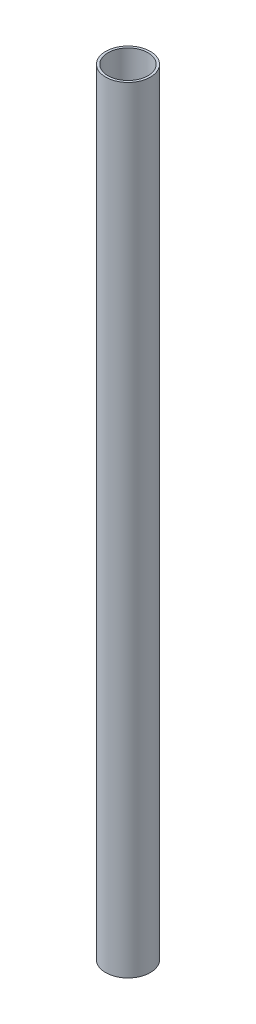
from build123d import *

# Parameters (mm, degrees)
SKETCH1_R           = 9.5
SKETCH1_R_2         = 8.5
BOSS_EXTRUDE1_DEPTH = 330


with BuildPart() as part:
    # Sketch1 → Boss-Extrude1 (new body)
    with BuildSketch(Plane(origin=(0, 0, 0), x_dir=(1, 0, 0), z_dir=(0, 1, 0))):
        with Locations(Location((0, 0, 0), (0, 0, 270))):
            Circle(SKETCH1_R)
        with Locations(Location((0, 0, 0), (0, 0, 270))):
            Circle(SKETCH1_R_2, mode=Mode.SUBTRACT)
    extrude(amount=BOSS_EXTRUDE1_DEPTH)


solid = part.part
